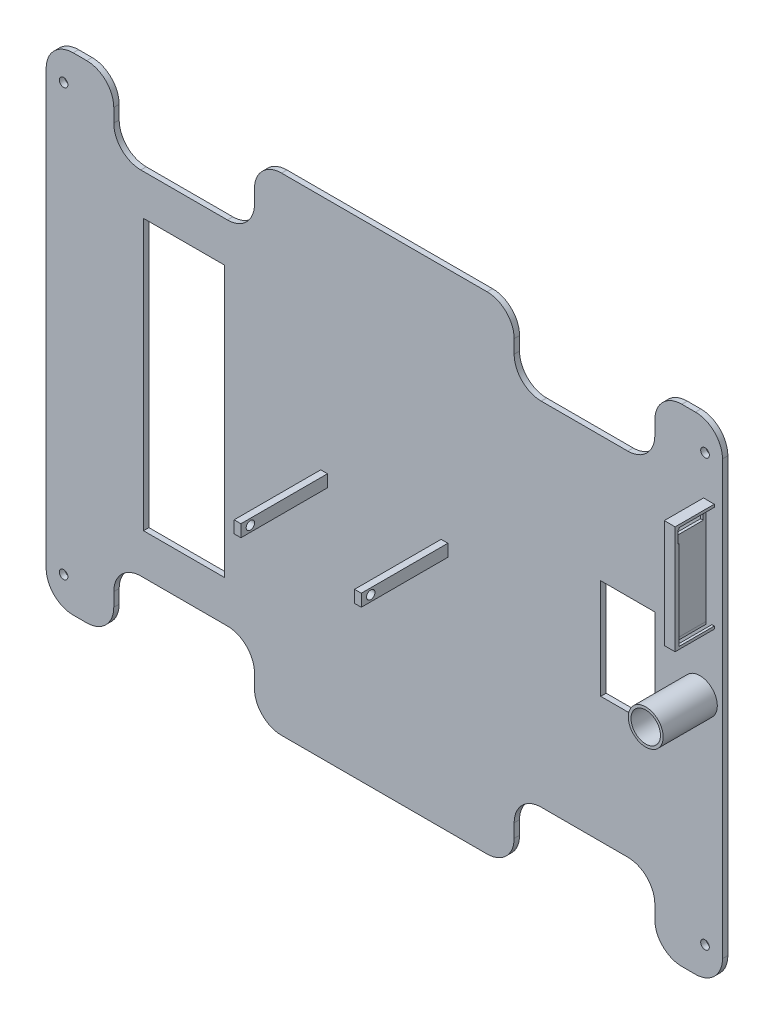
from build123d import *

# Parameters (mm, degrees)
BOSS_EXTRU_1_DEPTH       = 2
ESQUISSE2_R              = 1.6
ENL_V_MAT_EXTRU_1_DEPTH  = 155.04220201
CONG_1_R                 = 10
ESQUISSE5_W              = 20
ESQUISSE5_H              = 37
ENL_V_MAT_EXTRU_4_DEPTH  = 10
ESQUISSE6_W              = 4
ESQUISSE6_H              = 40
BOSS_EXTRU_3_DEPTH       = 14.5
ESQUISSE10_W             = 12.3
ESQUISSE10_H             = 4.5
ENL_V_MAT_EXTRU_5_DEPTH  = 12.1
ESQUISSE9_W              = 13
ESQUISSE9_H              = 38
ENL_V_MAT_EXTRU_6_DEPTH  = 3
ESQUISSE11_W             = 2.2
ESQUISSE11_H             = 13
ENL_V_MAT_EXTRU_7_DEPTH  = 3
ESQUISSE14_R             = 6.45
BOSS_EXTRU_4_DEPTH       = 20
ESQUISSE15_R             = 5.45
ENL_V_MAT_EXTRU_8_DEPTH  = 156.592416268
ESQUISSE17_W             = 30
ESQUISSE17_H             = 100
ENL_V_MAT_EXTRU_10_DEPTH = 156.32224567
ESQUISSE18_W             = 2.5
ESQUISSE18_H             = 4.5
BOSS_EXTRU_5_DEPTH       = 32
ESQUISSE19_R             = 1.55
ENL_V_MAT_EXTRU_11_DEPTH = 177.567975579


with BuildPart() as part:
    # Esquisse1 → Boss.-Extru.1 (new body)
    with BuildSketch(Plane.XY):
        Polygon((100, -90), (125, -90), (125, 90), (100, 90), (100, 65), (48, 65), (48, 90), (-48, 90), (-48, 65), (-100, 65), (-100, 90), (-125, 90), (-125, -90), (-100, -90), (-100, -65), (-48, -65), (-48, -90), (48, -90), (48, -65), (100, -65), align=None)
    extrude(amount=-BOSS_EXTRU_1_DEPTH)

    # Esquisse2 → Enlèv. mat.-Extru.1 (cut, through all)
    with BuildSketch(Plane(origin=(0, 0, -2), x_dir=(-1, 0, 0), z_dir=(0, 0, -1))):
        with Locations((-118.55, 78.76)):
            Circle(ESQUISSE2_R)
        with Locations(Location((118.55, 78.76, 0), (0, 0, 180))):
            Circle(ESQUISSE2_R)
        with Locations((118.55, -78.76)):
            Circle(ESQUISSE2_R)
        with Locations(Location((-118.55, -78.76, 0), (0, 0, 180))):
            Circle(ESQUISSE2_R)
    extrude(amount=-ENL_V_MAT_EXTRU_1_DEPTH, mode=Mode.SUBTRACT)

    # Congé1
    cong_1_edges = [part.edges().sort_by_distance(p)[0] for p in [
        (-100, 90, -1),
        (-48, 90, -1),
        (-48, 65, -1),
        (-100, 65, -1),
        (100, 65, -1),
        (48, 65, -1),
        (48, 90, -1),
        (100, 90, -1),
        (48, -90, -1),
        (48, -65, -1),
        (100, -65, -1),
        (100, -90, -1),
        (-100, -65, -1),
        (-48, -65, -1),
        (-48, -90, -1),
        (-100, -90, -1),
        (125, 90, -1),
        (125, -90, -1),
        (-125, -90, -1),
        (-125, 90, -1),
    ]]
    fillet(cong_1_edges, radius=CONG_1_R)

    # Esquisse5 → Enlèv. mat.-Extru.4 (cut)
    with BuildSketch(Plane(origin=(0, 0, -2), x_dir=(-1, 0, 0), z_dir=(0, 0, -1))):
        with Locations((-90, 0)):
            Rectangle(ESQUISSE5_W, ESQUISSE5_H)
    extrude(amount=-ENL_V_MAT_EXTRU_4_DEPTH, mode=Mode.SUBTRACT)

    # Esquisse6 → Boss.-Extru.3 (add)
    with BuildSketch(Plane.XY):
        with Locations((120, 44)):
            Rectangle(ESQUISSE6_W, ESQUISSE6_H)
    extrude(amount=BOSS_EXTRU_3_DEPTH)

    # Esquisse10 → Enlèv. mat.-Extru.5 (cut)
    with BuildSketch(Plane(origin=(122, 0, 0), x_dir=(0, 0, -1), z_dir=(1, 0, 0))):
        with Locations((-7.25, 60.15)):
            Rectangle(ESQUISSE10_W, ESQUISSE10_H)
    extrude(amount=-ENL_V_MAT_EXTRU_5_DEPTH, mode=Mode.SUBTRACT)

    # Esquisse9 → Enlèv. mat.-Extru.6 (cut)
    with BuildSketch(Plane(origin=(122, 0, 0), x_dir=(0, 0, -1), z_dir=(1, 0, 0))):
        with Locations((-6.5, 44)):
            Rectangle(ESQUISSE9_W, ESQUISSE9_H)
    extrude(amount=-ENL_V_MAT_EXTRU_6_DEPTH, mode=Mode.SUBTRACT)

    # Esquisse11 → Enlèv. mat.-Extru.7 (cut)
    with BuildSketch(Plane(origin=(0, 25, 0), x_dir=(1, 0, 0), z_dir=(0, 1, 0))):
        with Locations((120, -6.5)):
            Rectangle(ESQUISSE11_W, ESQUISSE11_H)
    extrude(amount=-ENL_V_MAT_EXTRU_7_DEPTH, mode=Mode.SUBTRACT)

    # Esquisse14 → Boss.-Extru.4 (add)
    with BuildSketch(Plane.XY):
        with Locations(Location((116.644469063, 0, 0), (0, 0, 180))):
            Circle(ESQUISSE14_R)
    extrude(amount=BOSS_EXTRU_4_DEPTH)

    # Esquisse15 → Enlèv. mat.-Extru.8 (cut, through all)
    with BuildSketch(Plane.XY.offset(20)):
        with Locations((116.644469063, 0)):
            Circle(ESQUISSE15_R)
    extrude(amount=-ENL_V_MAT_EXTRU_8_DEPTH, mode=Mode.SUBTRACT)

    # Esquisse17 → Enlèv. mat.-Extru.10 (cut, through all)
    with BuildSketch(Plane.XY):
        with Locations((-74, 0)):
            Rectangle(ESQUISSE17_W, ESQUISSE17_H)
    extrude(amount=-ENL_V_MAT_EXTRU_10_DEPTH, mode=Mode.SUBTRACT)

    # Esquisse18 → Boss.-Extru.5 (add)
    with BuildSketch(Plane.XY):
        with Locations((-22.25, 0)):
            Rectangle(ESQUISSE18_W, ESQUISSE18_H)
        with Locations((22.25, 0)):
            Rectangle(ESQUISSE18_W, ESQUISSE18_H)
    extrude(amount=BOSS_EXTRU_5_DEPTH)

    # Esquisse19 → Enlèv. mat.-Extru.11 (cut, through all)
    with BuildSketch(Plane(origin=(23.5, 0, 0), x_dir=(0, 0, -1), z_dir=(1, 0, 0))):
        with Locations((-28.5, 0)):
            Circle(ESQUISSE19_R)
    extrude(amount=-ENL_V_MAT_EXTRU_11_DEPTH, mode=Mode.SUBTRACT)


solid = part.part
